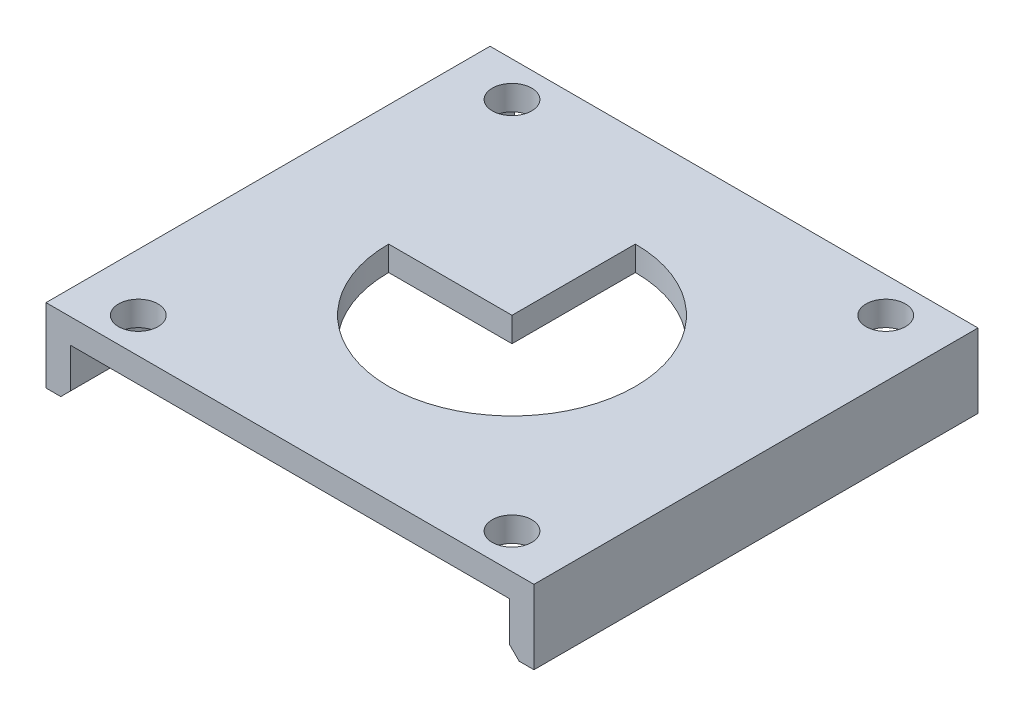
from build123d import *

# Parameters (mm, degrees)
SKETCH1_W           = 98.9
SKETCH1_H           = 90
SKETCH1_R           = 4
BOSS_EXTRUDE1_DEPTH = 5
SKETCH2_W           = 5
SKETCH2_H           = 90
BOSS_EXTRUDE2_DEPTH = 10
CHAMFER1_SIZE       = 2


with BuildPart() as part:
    # Sketch1 → Boss-Extrude1 (new body)
    with BuildSketch(Plane(origin=(0, 0, 0), x_dir=(1, 0, 0), z_dir=(0, 1, 0))):
        Rectangle(SKETCH1_W, SKETCH1_H)
        with Locations(Location((-37.875, -37.875, 0), (0, 0, 270))):
            Circle(SKETCH1_R, mode=Mode.SUBTRACT)
        with Locations(Location((37.875, -37.875, 0), (0, 0, 270))):
            Circle(SKETCH1_R, mode=Mode.SUBTRACT)
        with Locations(Location((-37.875, 37.875, 0), (0, 0, 270))):
            Circle(SKETCH1_R, mode=Mode.SUBTRACT)
        with BuildLine():
            Line((-25, 0), (0, 0))
            Line((0, 0), (0, 25))
            ThreePointArc((0, 25), (17.67766953, -17.67766953), (-25, 0))
        make_face(mode=Mode.SUBTRACT)
        with Locations(Location((37.875, 37.875, 0), (0, 0, 270))):
            Circle(SKETCH1_R, mode=Mode.SUBTRACT)
    extrude(amount=BOSS_EXTRUDE1_DEPTH)

    # Sketch2 → Boss-Extrude2 (add)
    with BuildSketch(Plane.XZ):
        with Locations((-46.95, 0)):
            Rectangle(SKETCH2_W, SKETCH2_H)
        with Locations((46.95, 0)):
            Rectangle(SKETCH2_W, SKETCH2_H)
    extrude(amount=BOSS_EXTRUDE2_DEPTH)

    # Chamfer1
    chamfer1_edges = [part.edges().sort_by_distance(p)[0] for p in [
        (-44.45, -10, 0),
        (44.45, -10, 0),
    ]]
    chamfer(chamfer1_edges, length=CHAMFER1_SIZE)


solid = part.part
